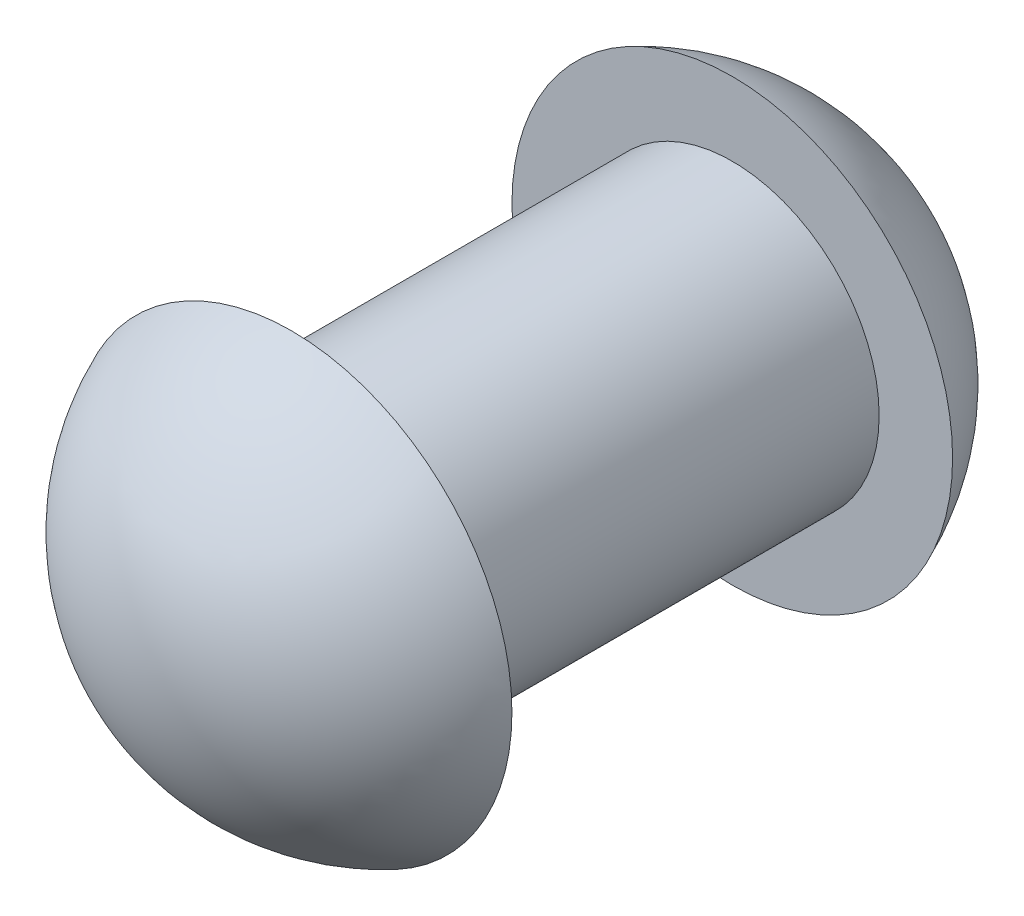
from build123d import *


with BuildPart() as part:
    # 草图1 → 旋转1 (revolve)
    with BuildSketch(Plane(origin=(0, 0, 0), x_dir=(1, 0, 0), z_dir=(0, 1, 0))):
        with BuildLine():
            Line((0, 2.5), (0, -2.5))
            ThreePointArc((0, -2.5), (0.901387819, -2.227081728), (1.5, -1.5))
            Line((1.5, -1.5), (1, -1.5))
            Line((1, -1.5), (1, 1.5))
            Line((1, 1.5), (1.5, 1.5))
            ThreePointArc((1.5, 1.5), (0.901387819, 2.227081728), (0, 2.5))
        make_face()
    revolve(axis=Axis((0, 0, -2.5), (0, 0, 1)))


solid = part.part
